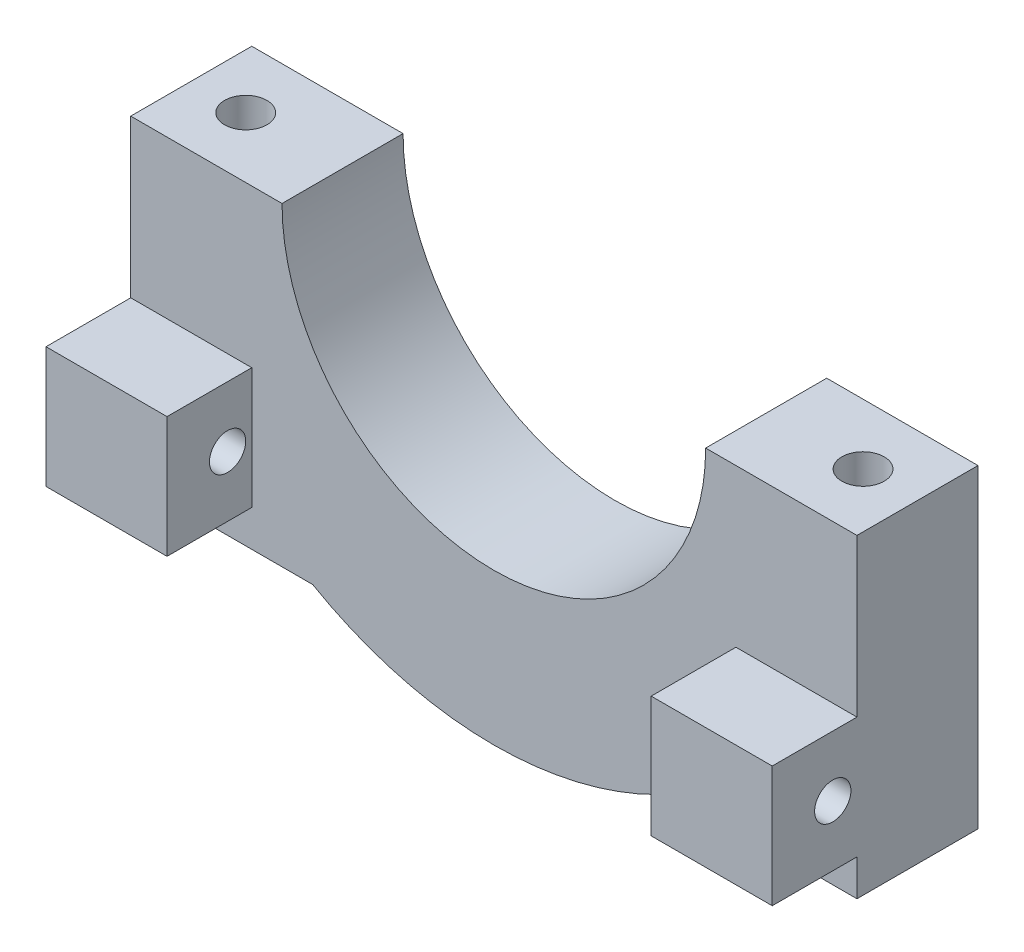
from build123d import *

# Parameters (mm, degrees)
Y_KSEKLIK_EKSTR_ZYON1_DEPTH = 10
KES_EKSTR_ZYON3_REACH       = 45.589
IZIM7_R                     = 1.75
SKETCH1_W                   = 10
SKETCH1_H                   = 10
BOSS_EXTRUDE1_DEPTH         = 7
CUT_EXTRUDE1_REACH          = 71.203
SKETCH2_R                   = 1.5


with BuildPart() as part:
    # Çizim2 → Yükseklik-Ekstrüzyon1 (new body)
    with BuildSketch(Plane.XY):
        with BuildLine():
            Line((14.966629547, -26), (30, -26))
            Line((30, -26), (30, 0))
            Line((30, 0), (17.5, 0))
            ThreePointArc((17.5, 0), (0, -17.5), (-17.5, 0))
            Line((-17.5, 0), (-30, 0))
            Line((-30, 0), (-30, -26))
            Line((-30, -26), (-14.966629547, -26))
            ThreePointArc((-14.966629547, -26), (0, -30), (14.966629547, -26))
        make_face()
    extrude(amount=Y_KSEKLIK_EKSTR_ZYON1_DEPTH)

    # Çizim7 → Kes-Ekstrüzyon3 (cut, up to next)
    with BuildSketch(Plane(origin=(0, 0, 0), x_dir=(1, 0, 0), z_dir=(0, 1, 0)), mode=Mode.PRIVATE) as kes_ekstr_zyon3_sk1:
        with Locations(Location((25.5, -5, 0), (0, 0, 270))):
            Circle(IZIM7_R)
    kes_ekstr_zyon3_tool1 = extrude(kes_ekstr_zyon3_sk1.sketch, amount=-KES_EKSTR_ZYON3_REACH, mode=Mode.PRIVATE) & part.part
    kes_ekstr_zyon3 = kes_ekstr_zyon3_tool1.solids().sort_by_distance((25.5, 0, 5))[0]
    add(kes_ekstr_zyon3, mode=Mode.SUBTRACT)

    # Aynalama1: Kes-Ekstrüzyon3 across plane
    add(kes_ekstr_zyon3.mirror(Plane.ZY), mode=Mode.SUBTRACT)

    # Sketch1 → Boss-Extrude1 (add)
    with BuildSketch(Plane.XY.offset(10)):
        with Locations((-25, -18)):
            Rectangle(SKETCH1_W, SKETCH1_H)
    boss_extrude1 = extrude(amount=BOSS_EXTRUDE1_DEPTH)

    # Sketch2 → Cut-Extrude1 (cut, up to next)
    with BuildSketch(Plane.ZY.offset(30), mode=Mode.PRIVATE) as cut_extrude1_sk1:
        with Locations((12, -18)):
            Circle(SKETCH2_R)
    cut_extrude1_tool1 = extrude(cut_extrude1_sk1.sketch, amount=-CUT_EXTRUDE1_REACH, mode=Mode.PRIVATE) & part.part
    cut_extrude1 = cut_extrude1_tool1.solids().sort_by_distance((-30, -18, 12))[0]
    add(cut_extrude1, mode=Mode.SUBTRACT)

    # Mirror1: Boss-Extrude1, Cut-Extrude1 across plane
    add(boss_extrude1.mirror(Plane(origin=(0, 0, 0), x_dir=(0, 0, 1), z_dir=(1, 0, 0))))
    add(cut_extrude1.mirror(Plane(origin=(0, 0, 0), x_dir=(0, 0, 1), z_dir=(1, 0, 0))), mode=Mode.SUBTRACT)


solid = part.part
